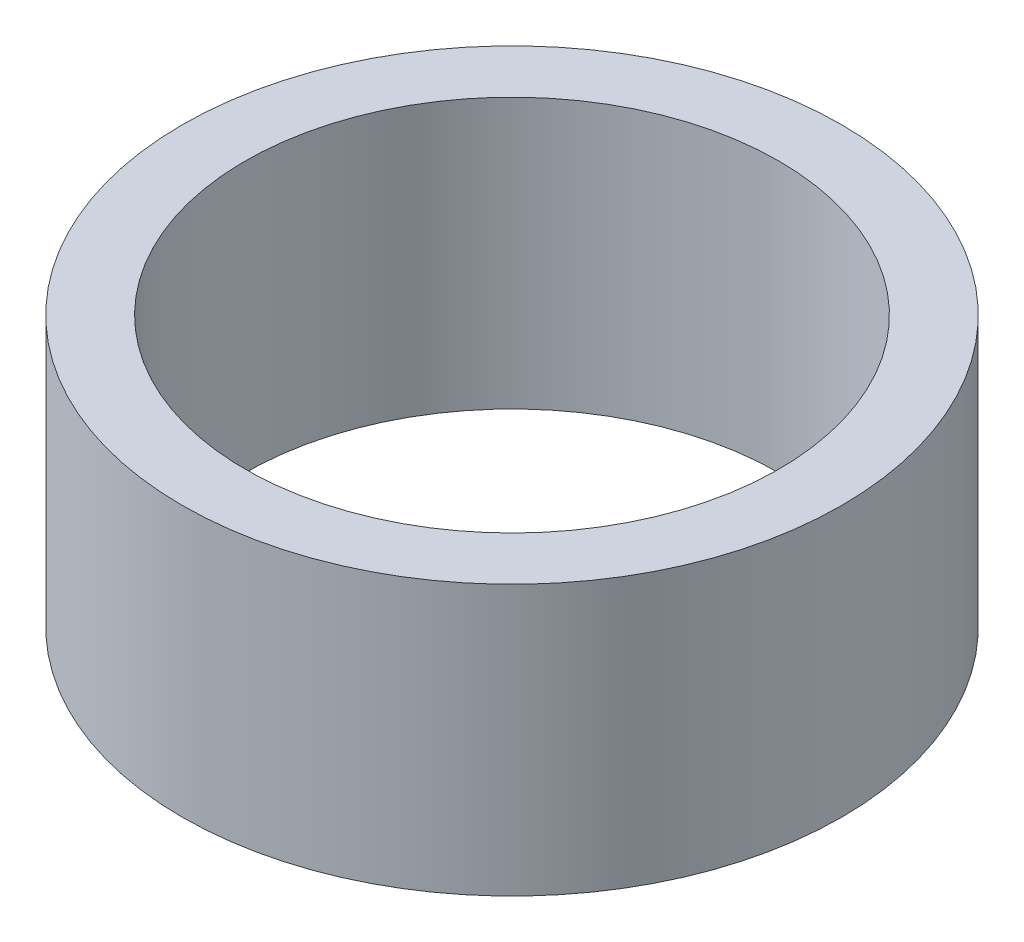
from build123d import *

# Parameters (mm, degrees)
SKETCH_1_R      = 31.5
SKETCH_1_R_2    = 25.5
EXTRUDE_1_DEPTH = 25.8


with BuildPart() as part:
    # 草图1 → 凸台-拉伸1 (new body)
    with BuildSketch(Plane(origin=(0, 0, 0), x_dir=(1, 0, 0), z_dir=(0, 1, 0))):
        with Locations(Location((0, 0, 0), (0, 0, 90))):
            Circle(SKETCH_1_R)
        with Locations(Location((0, 0, 0), (0, 0, 90))):
            Circle(SKETCH_1_R_2, mode=Mode.SUBTRACT)
    extrude(amount=EXTRUDE_1_DEPTH)


solid = part.part
